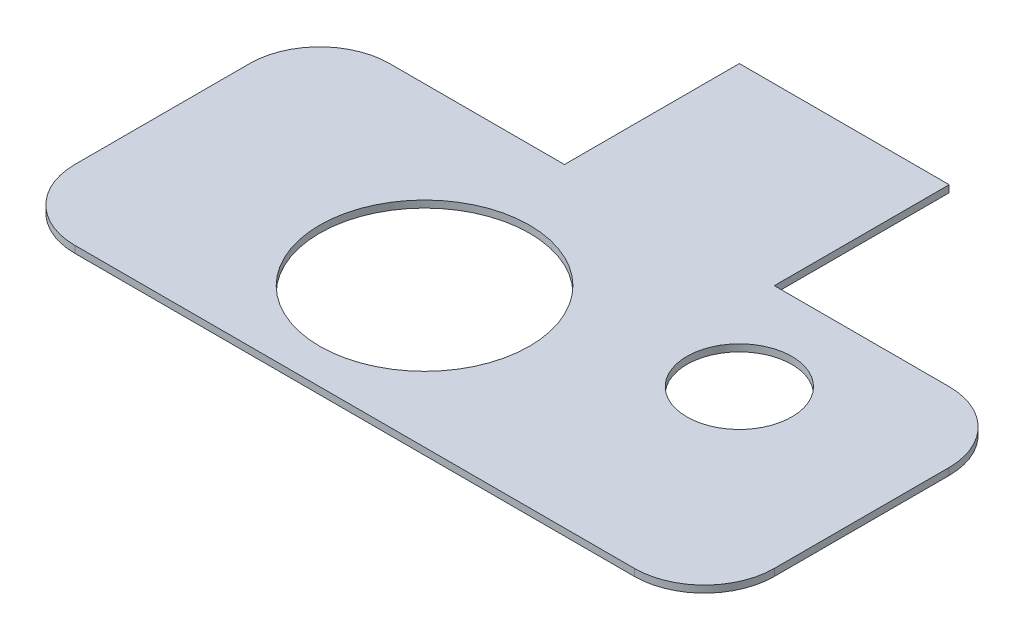
from build123d import *

# Parameters (mm, degrees)
SKETCH1_R           = 15
SKETCH1_R_2         = 7.5
BOSS_EXTRUDE1_DEPTH = 1


with BuildPart() as part:
    # Sketch1 → Boss-Extrude1 (new body)
    with BuildSketch(Plane(origin=(0, 0, 0), x_dir=(1, 0, 0), z_dir=(0, 1, 0))):
        with BuildLine():
            Line((65, 45), (90, 45))
            ThreePointArc((90, 45), (97.071067812, 42.071067812), (100, 35))
            Line((100, 35), (100, 10))
            ThreePointArc((100, 10), (97.071067812, 2.928932188), (90, 0))
            Line((90, 0), (10, 0))
            ThreePointArc((10, 0), (2.928932188, 2.928932188), (0, 10))
            Line((0, 10), (0, 35))
            ThreePointArc((0, 35), (2.928932188, 42.071067812), (10, 45))
            Line((10, 45), (35, 45))
            Line((35, 45), (35, 70))
            Line((35, 70), (65, 70))
            Line((65, 70), (65, 45))
        make_face()
        with Locations(Location((40, 20, 0), (0, 0, 270))):
            Circle(SKETCH1_R, mode=Mode.SUBTRACT)
        with Locations(Location((75, 30, 0), (0, 0, 270))):
            Circle(SKETCH1_R_2, mode=Mode.SUBTRACT)
    extrude(amount=BOSS_EXTRUDE1_DEPTH)


solid = part.part
